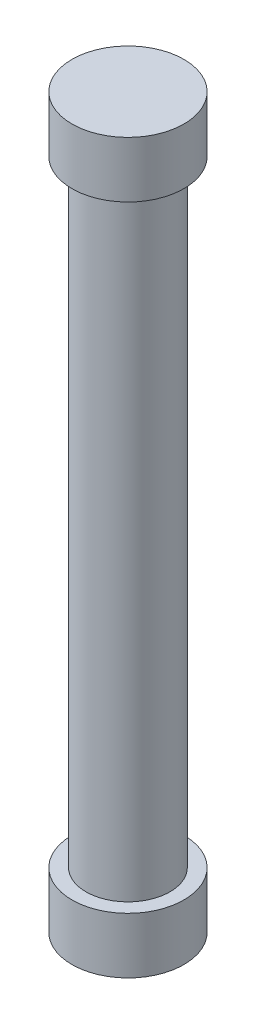
from build123d import *


with BuildPart() as part:
    # Sketch1 → Revolve1 (revolve)
    with BuildSketch(Plane.XY):
        Polygon((0, 5.073170732), (0, -20.926829268), (-2, -20.926829268), (-2, -18.926829268), (-1.5, -18.926829268), (-1.5, 3.073170732), (-2, 3.073170732), (-2, 5.073170732), align=None)
    revolve(axis=Axis((0, 5.073170732, 0), (0, -1, 0)))


solid = part.part
